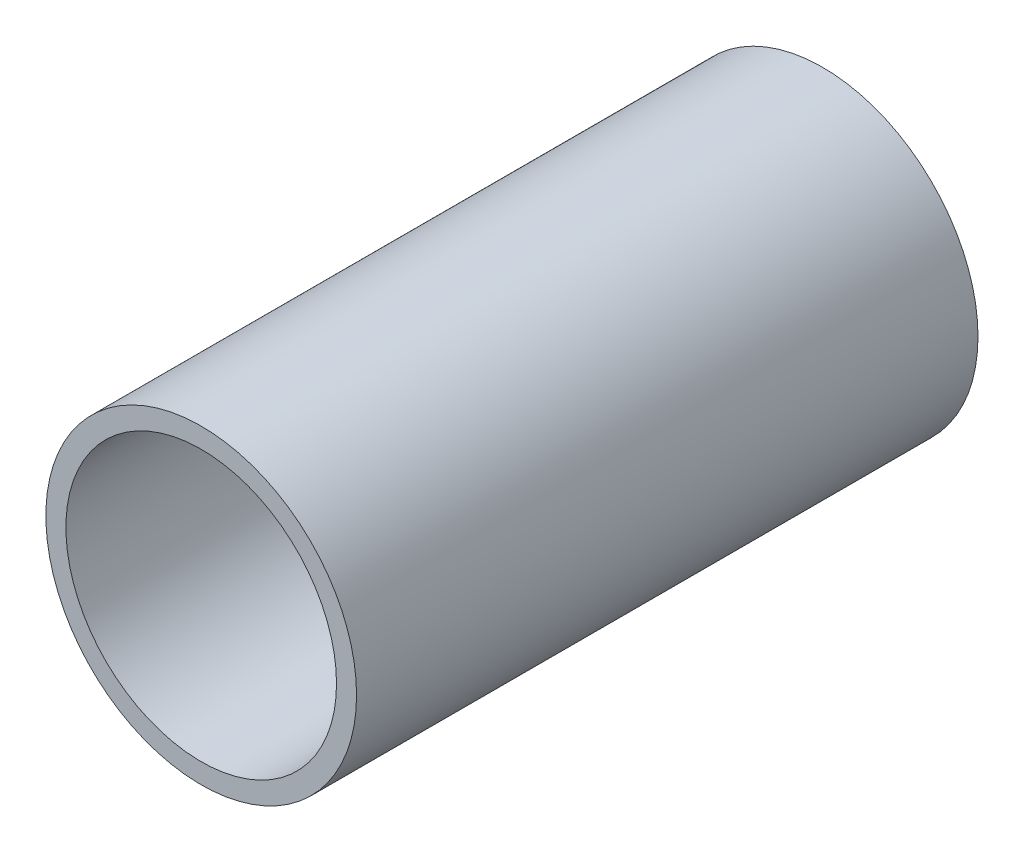
from build123d import *

# Parameters (mm, degrees)
SKETCH_1_R      = 7.75
SKETCH_1_R_2    = 6.75
EXTRUDE_1_DEPTH = 31


with BuildPart() as part:
    # 草图1 → 凸台-拉伸1 (new body)
    with BuildSketch(Plane.XY):
        Circle(SKETCH_1_R)
        Circle(SKETCH_1_R_2, mode=Mode.SUBTRACT)
    extrude(amount=EXTRUDE_1_DEPTH)


solid = part.part
